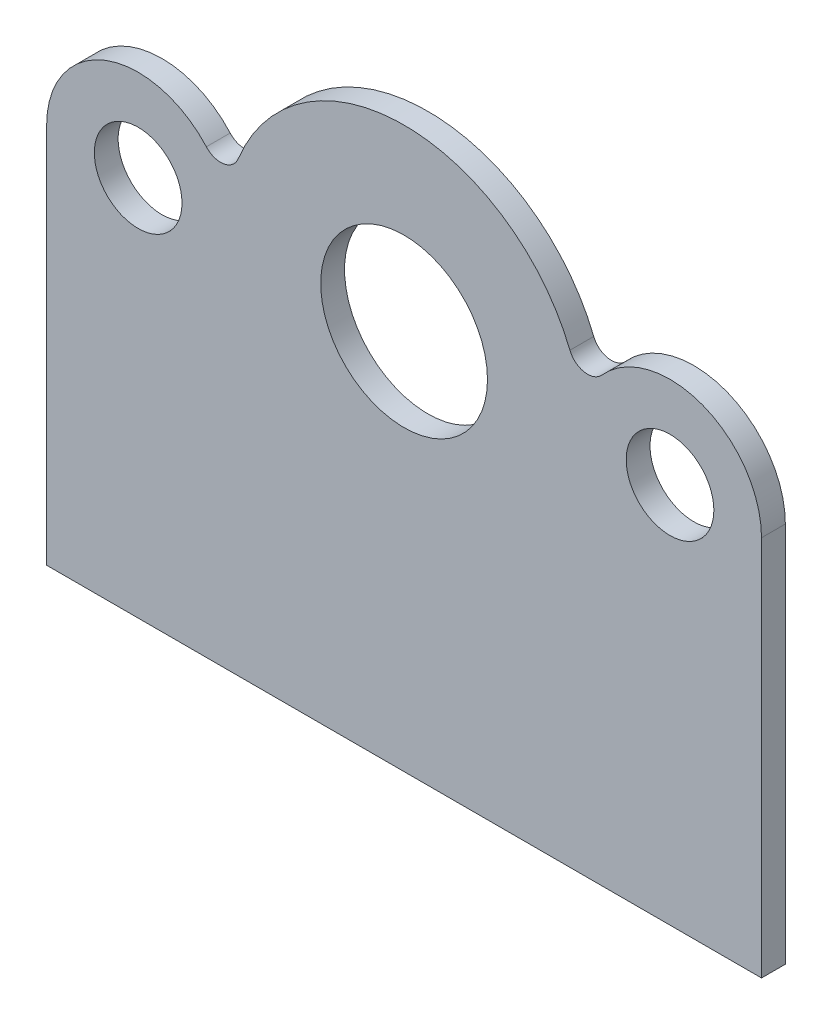
from build123d import *

# Parameters (mm, degrees)
SKETCH1_R           = 5.55625
SKETCH1_R_2         = 2.921
BOSS_EXTRUDE1_DEPTH = 1.5875


with BuildPart() as part:
    # Sketch1 → Boss-Extrude1 (new body)
    with BuildSketch(Plane.XY):
        with BuildLine():
            Line((0, 0), (47.625, 0))
            Line((47.625, 0), (47.625, 25.4))
            ThreePointArc((47.625, 25.4), (43.704494442, 31.094597434), (36.985748053, 29.464489851))
            ThreePointArc((36.985748053, 29.464489851), (35.819445625, 29.06042219), (34.860756534, 29.83788425))
            ThreePointArc((34.860756534, 29.83788425), (23.8125, 37.30625), (12.764243466, 29.83788425))
            ThreePointArc((12.764243466, 29.83788425), (11.805554375, 29.06042219), (10.639251947, 29.464489851))
            ThreePointArc((10.639251947, 29.464489851), (3.920505558, 31.094597434), (0, 25.4))
            Line((0, 25.4), (0, 0))
        make_face()
        with Locations((23.8125, 25.4)):
            Circle(SKETCH1_R, mode=Mode.SUBTRACT)
        with Locations((6.096, 25.4)):
            Circle(SKETCH1_R_2, mode=Mode.SUBTRACT)
        with Locations((41.529, 25.4)):
            Circle(SKETCH1_R_2, mode=Mode.SUBTRACT)
    extrude(amount=BOSS_EXTRUDE1_DEPTH)


solid = part.part
